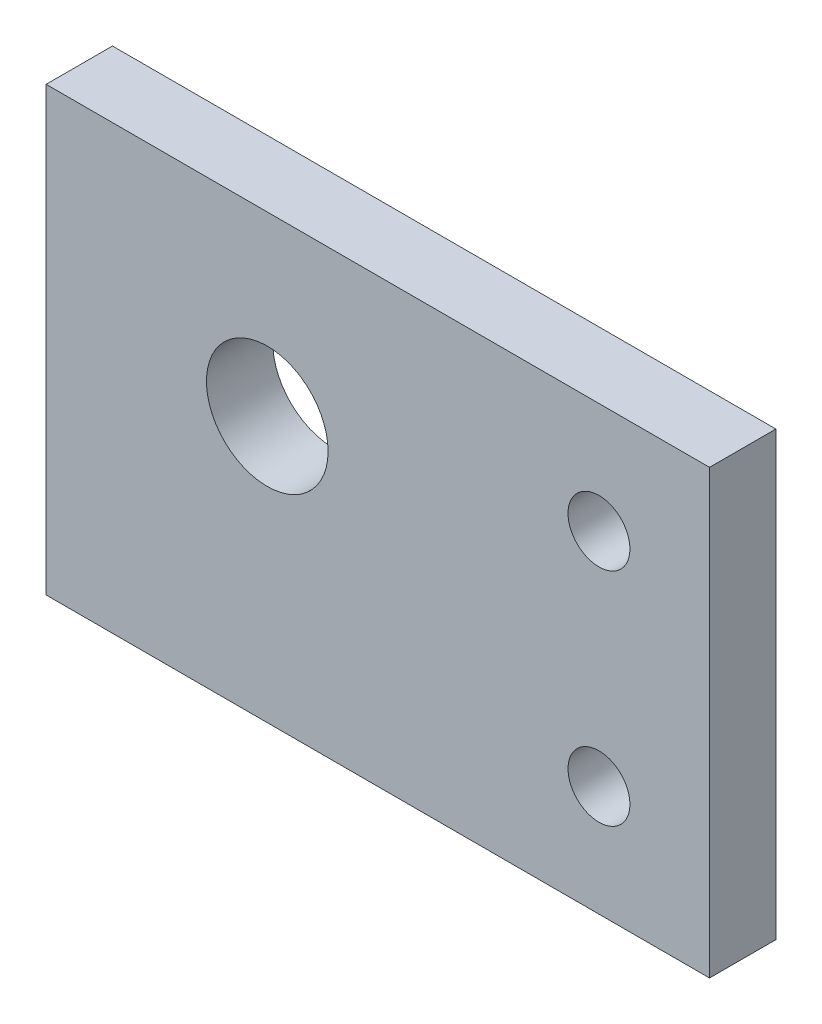
from build123d import *

# Parameters (mm, degrees)
SKETCH1_W           = 30
SKETCH1_H           = 20
SKETCH1_R           = 2.75
SKETCH1_R_2         = 1.4
BOSS_EXTRUDE1_DEPTH = 3


with BuildPart() as part:
    # Sketch1 → Boss-Extrude1 (new body)
    with BuildSketch(Plane.XY):
        with Locations((-9.35483871, 5.967741935)):
            Rectangle(SKETCH1_W, SKETCH1_H)
        with Locations((-14.35483871, 7.967741935)):
            Circle(SKETCH1_R, mode=Mode.SUBTRACT)
        with Locations((0.64516129, 10.967741935)):
            Circle(SKETCH1_R_2, mode=Mode.SUBTRACT)
        with Locations((0.64516129, 0.967741935)):
            Circle(SKETCH1_R_2, mode=Mode.SUBTRACT)
    extrude(amount=BOSS_EXTRUDE1_DEPTH)


solid = part.part
